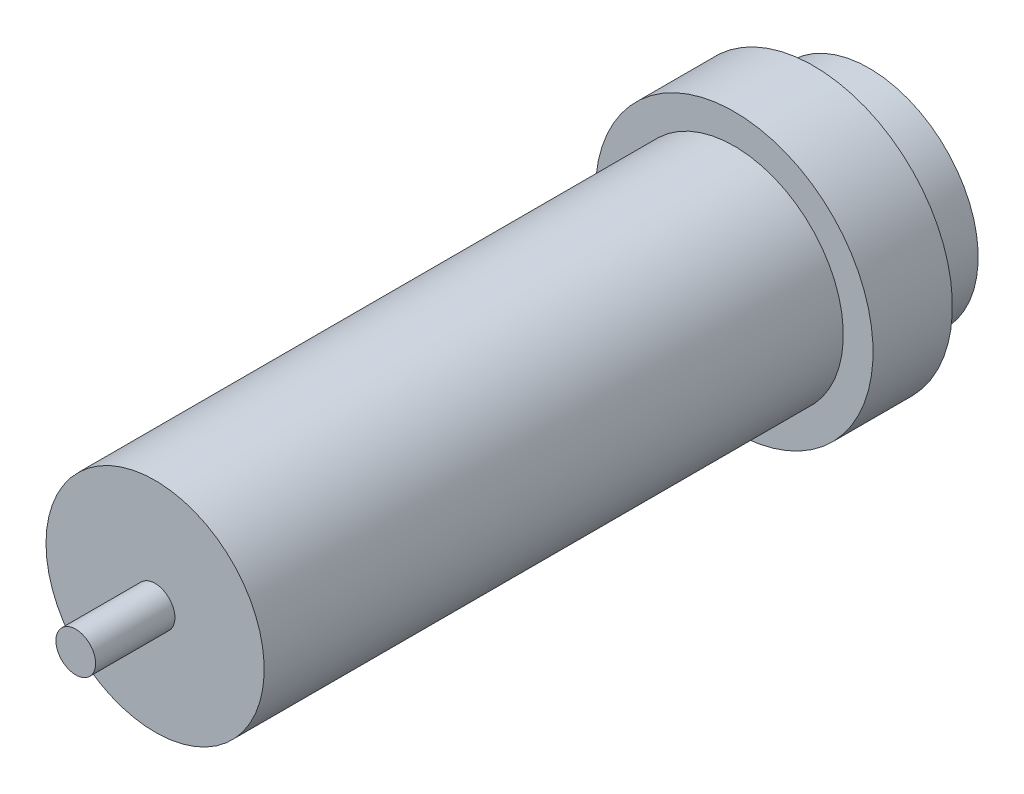
from build123d import *

# Parameters (mm, degrees)
SKETCH1_R                = 1.25
BOSS_EXTRUDE1_DEPTH      = 2.5
SKETCH2_R                = 6.875
BOSS_EXTRUDE2_DEPTH      = 45
BOSS_EXTRUDE3_DEPTH      = 2.5
BOSS_EXTRUDE3_DEPTH_BACK = 2.5
SKETCH3_R                = 8.75
SKETCH5_R                = 1.25
BOSS_EXTRUDE4_DEPTH      = 5


with BuildPart() as part:
    # Sketch1 → Boss-Extrude1 (new body)
    with BuildSketch(Plane.XY):
        Circle(SKETCH1_R)
    extrude(amount=BOSS_EXTRUDE1_DEPTH)

    # Sketch2 → Boss-Extrude2 (add)
    with BuildSketch(Plane.XY.offset(2.5)):
        with Locations(Location((0, 0, 0), (0, 0, 180))):
            Circle(SKETCH2_R)
    extrude(amount=BOSS_EXTRUDE2_DEPTH)

    # Sketch3 → Boss-Extrude3 (add, two sides: drawn at the far end of the back side and taken through both)
    with BuildSketch(Plane(origin=(0, 0, 8.5), x_dir=(-1, 0, 0), z_dir=(0, 0, -1)).offset(-BOSS_EXTRUDE3_DEPTH_BACK)):
        Circle(SKETCH3_R)
    extrude(amount=BOSS_EXTRUDE3_DEPTH + BOSS_EXTRUDE3_DEPTH_BACK)

    # Sketch5 → Boss-Extrude4 (add)
    with BuildSketch(Plane.XY.offset(47.5)):
        Circle(SKETCH5_R)
    extrude(amount=BOSS_EXTRUDE4_DEPTH)


solid = part.part
